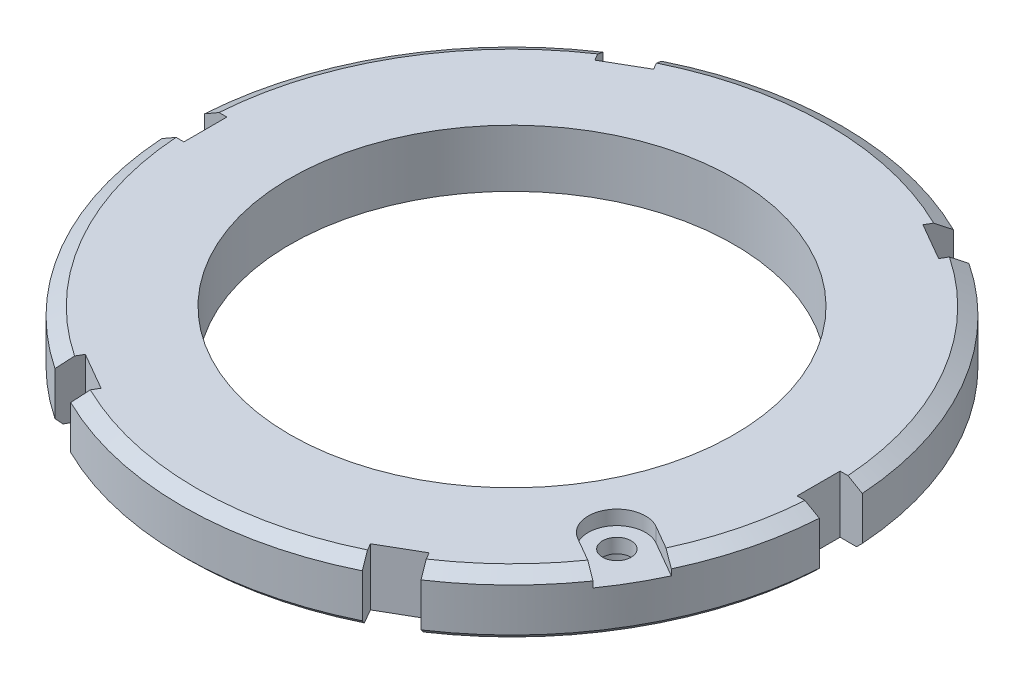
from build123d import *

# Parameters (mm, degrees)
SKETCH_3_R               = 5
CUT_EXTRUDE_1_DEPTH      = 164.859696082
SKETCH_4_R               = 10
CUT_EXTRUDE_2_DEPTH      = 10
CUT_EXTRUDE_START        = -5
CUT_EXTRUDE_3_DEPTH      = 5
CHAMFER_2_SIZE           = 2
SKETCH_7_W               = 8
SKETCH_7_H               = 20
CUT_EXTRUDE_7_DEPTH      = 7.5
PATTERN_CIRCULAR_1_COUNT = 6


with BuildPart() as part:
    # Эскиз1 → Повернуть1 (revolve)
    with BuildSketch(Plane.XY, mode=Mode.PRIVATE) as revolve_1_sk:
        Polygon((115, 23.777702661), (77.5, 23.777702661), (77.5, 43.777702661), (110, 43.777702661), (115, 40.890951315), align=None)
    revolve(revolve_1_sk.sketch.rotate(Axis((0, 147.550331696, 0), (0, -1, 0)), 90), axis=Axis((0, 147.550331696, 0), (0, -1, 0)))

    # Эскиз3 → Вырез-Вытянуть1 (cut, through all)
    with BuildSketch(Plane(origin=(0, 43.777702661, 0), x_dir=(1, 0, 0), z_dir=(0, 1, 0))):
        with Locations(Location((86.602540378, -50, 0), (0, 0, 270))):
            Circle(SKETCH_3_R)
    extrude(amount=-CUT_EXTRUDE_1_DEPTH, mode=Mode.SUBTRACT)

    # Эскиз4 → Вырез-Вытянуть2 (cut)
    with BuildSketch(Plane.XZ.offset(-23.777702661)):
        with Locations(Location((86.602540378, 50, 0), (0, 0, 270))):
            Circle(SKETCH_4_R)
    extrude(amount=-CUT_EXTRUDE_2_DEPTH, mode=Mode.SUBTRACT)

    # Эскиз5 → Вырез-Вытянуть3 (cut)
    with BuildSketch(Plane(origin=(0, 43.777702661, 0), x_dir=(1, 0, 0), z_dir=(0, 1, 0)).offset(CUT_EXTRUDE_START)):
        with BuildLine():
            Line((91.602540378, -41.339745962), (136.199116664, -67.087591285))
            Line((136.199116664, -67.087591285), (126.755895542, -84.729555796))
            Line((126.755895542, -84.729555796), (81.602540378, -58.660254038))
            ThreePointArc((81.602540378, -58.660254038), (77.942286341, -45), (91.602540378, -41.339745962))
        make_face()
    extrude(amount=CUT_EXTRUDE_3_DEPTH, mode=Mode.SUBTRACT)

    # Фаска2
    chamfer_2_edges = [part.edges().sort_by_distance(p)[0] for p in [
        (0, 23.777702661, -115),
    ]]
    chamfer(chamfer_2_edges, length=CHAMFER_2_SIZE)

    # Эскиз7 → Вырез-Вытянуть7 (cut, symmetric)
    with BuildSketch(Plane.XY):
        with Locations((-111, 33.777702661)):
            Rectangle(SKETCH_7_W, SKETCH_7_H)
    cut_extrude_7 = extrude(amount=CUT_EXTRUDE_7_DEPTH, both=True, mode=Mode.SUBTRACT)

    # Круговой массив1: Вырез-Вытянуть7 ×6 about axis
    pattern_circular_1_axis = Axis((0, 0, 0), (0, 1, 0))
    for i in range(1, PATTERN_CIRCULAR_1_COUNT):
        add(cut_extrude_7.rotate(pattern_circular_1_axis, i * 360 / PATTERN_CIRCULAR_1_COUNT), mode=Mode.SUBTRACT)


solid = part.part
